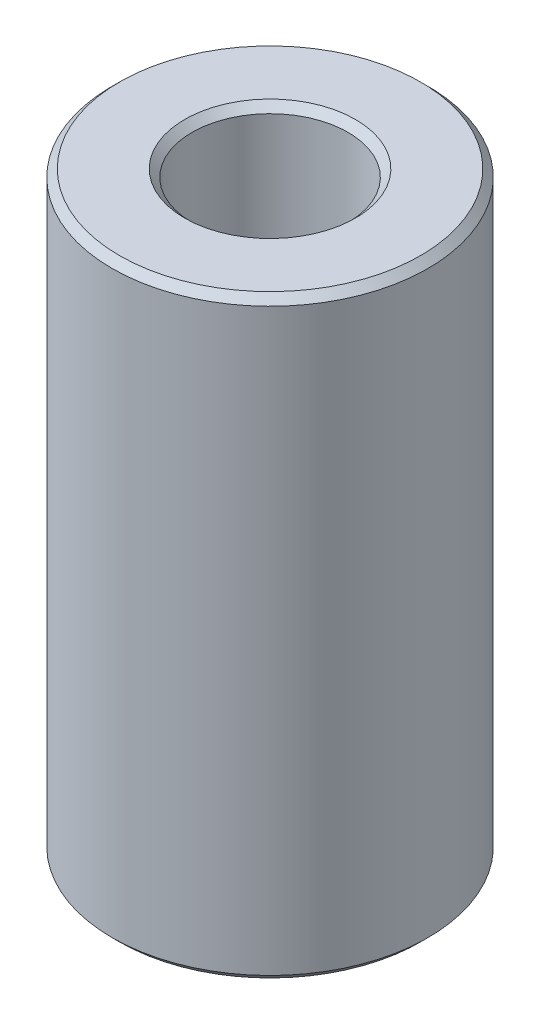
from build123d import *

# Parameters (mm, degrees)
SKETCH1_R           = 4.25
SKETCH1_R_2         = 2.1
BOSS_EXTRUDE1_DEPTH = 16
CHAMFER1_SIZE       = 0.2


with BuildPart() as part:
    # Sketch1 → Boss-Extrude1 (new body)
    with BuildSketch(Plane(origin=(0, 0, 0), x_dir=(1, 0, 0), z_dir=(0, 1, 0))):
        with Locations(Location((0, 0, 0), (0, 0, 270))):
            Circle(SKETCH1_R)
        with Locations(Location((0, 0, 0), (0, 0, 270))):
            Circle(SKETCH1_R_2, mode=Mode.SUBTRACT)
    extrude(amount=BOSS_EXTRUDE1_DEPTH)

    # Chamfer1
    chamfer1_edges = [part.edges().sort_by_distance(p)[0] for p in [
        (0, 0, -4.25),
        (0, 16, -4.25),
        (0, 0, -2.1),
        (0, 16, -2.1),
    ]]
    chamfer(chamfer1_edges, length=CHAMFER1_SIZE)


solid = part.part
